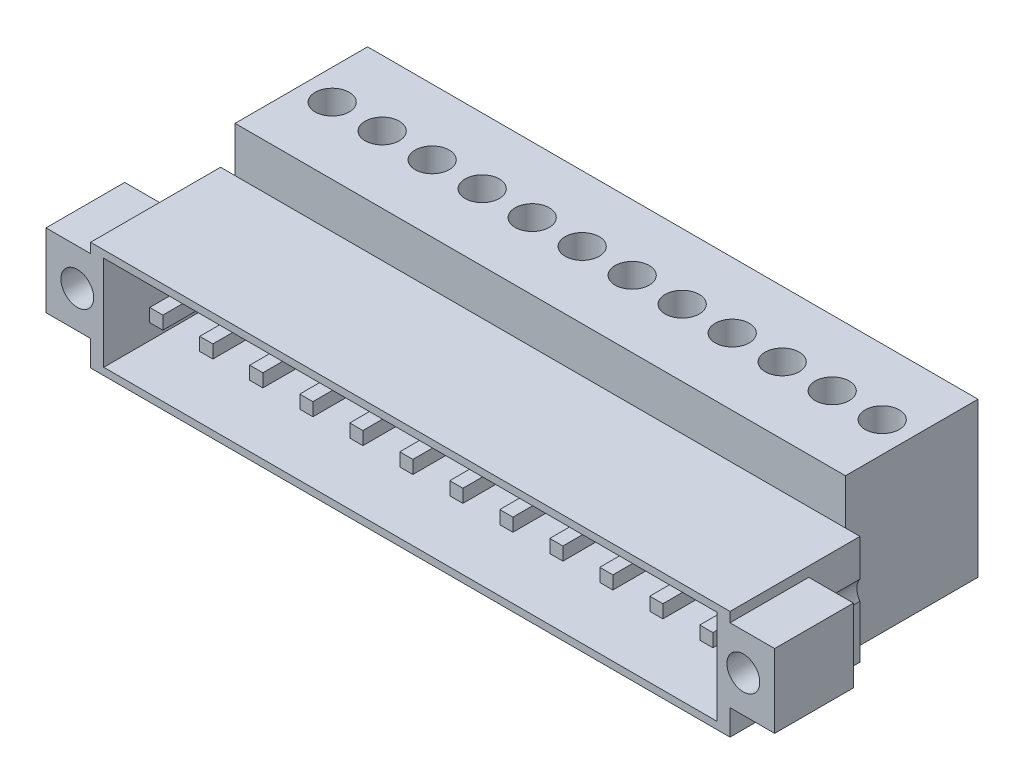
from build123d import *

# Parameters (mm, degrees)
SK_SHROUD_W             = 48.72
SK_SHROUD_H             = 8.3
SHROUD_DEPTH            = 9.9
SK_FLANGE_EARS_W        = 3.4
SK_FLANGE_EARS_H        = 5.6
FLANGE_EARS_DEPTH       = 6
SK_CAVITY_W             = 46.72
SK_CAVITY_H             = 7.2
CAVITY_DEPTH            = 7.6
SK_TERMINAL_BLOCK_W     = 46.51
SK_TERMINAL_BLOCK_H     = 11.75
TERMINAL_BLOCK_DEPTH    = 10.1
INSERT_HOLES_DEPTH      = 34.295909659
INSERT_HOLES_DEPTH_BACK = 34.295909659
SK_INSERT_HOLES_R       = 1.25
SK_CONTACT_PINS_W       = 1
SK_CONTACT_PINS_H       = 1
CONTACT_PINS_DEPTH      = 6
SK_WIRE_ENTRIES_W       = 2.6
SK_WIRE_ENTRIES_H       = 2.8
WIRE_ENTRIES_DEPTH      = 6
SK_CLAMP_SCREW_HOLES_R  = 1.3
CLAMP_SCREW_HOLES_DEPTH = 3


with BuildPart() as part:
    # SK Shroud → Shroud (new body)
    with BuildSketch(Plane.XY.offset(3)):
        with Locations((0, -0.6)):
            Rectangle(SK_SHROUD_W, SK_SHROUD_H)
    extrude(amount=-SHROUD_DEPTH)

    # SK Flange ears → Flange ears (add)
    with BuildSketch(Plane.XY.offset(3)):
        with Locations((26.06, 0)):
            Rectangle(SK_FLANGE_EARS_W, SK_FLANGE_EARS_H)
        with Locations((-26.06, 0)):
            Rectangle(SK_FLANGE_EARS_W, SK_FLANGE_EARS_H)
    extrude(amount=-FLANGE_EARS_DEPTH)

    # SK Cavity → Cavity (cut)
    with BuildSketch(Plane.XY.offset(3)):
        with Locations((0, -0.6)):
            Rectangle(SK_CAVITY_W, SK_CAVITY_H)
    extrude(amount=-CAVITY_DEPTH, mode=Mode.SUBTRACT)

    # SK Terminal block → Terminal block (add)
    with BuildSketch(Plane.XY.offset(-6.9)):
        with Locations((0, 1.125)):
            Rectangle(SK_TERMINAL_BLOCK_W, SK_TERMINAL_BLOCK_H)
    extrude(amount=-TERMINAL_BLOCK_DEPTH)

    # SK Insert holes → Insert holes (cut, two sides: drawn at the far end of the back side and taken through both)
    with BuildSketch(Plane.XY.offset(-INSERT_HOLES_DEPTH_BACK)):
        with Locations((-25.375, 0)):
            Circle(SK_INSERT_HOLES_R)
        with Locations((25.375, 0)):
            Circle(SK_INSERT_HOLES_R)
    extrude(amount=INSERT_HOLES_DEPTH + INSERT_HOLES_DEPTH_BACK, mode=Mode.SUBTRACT)

    # SK Contact pins → Contact pins (add)
    with BuildSketch(Plane.XY.offset(-4.6)):
        with Locations((-20.955, -0.6)):
            Rectangle(SK_CONTACT_PINS_W, SK_CONTACT_PINS_H)
        with Locations((-17.145, -0.6)):
            Rectangle(SK_CONTACT_PINS_W, SK_CONTACT_PINS_H)
        with Locations((-13.335, -0.6)):
            Rectangle(SK_CONTACT_PINS_W, SK_CONTACT_PINS_H)
        with Locations((-9.525, -0.6)):
            Rectangle(SK_CONTACT_PINS_W, SK_CONTACT_PINS_H)
        with Locations((-5.715, -0.6)):
            Rectangle(SK_CONTACT_PINS_W, SK_CONTACT_PINS_H)
        with Locations((-1.905, -0.6)):
            Rectangle(SK_CONTACT_PINS_W, SK_CONTACT_PINS_H)
        with Locations((1.905, -0.6)):
            Rectangle(SK_CONTACT_PINS_W, SK_CONTACT_PINS_H)
        with Locations((5.715, -0.6)):
            Rectangle(SK_CONTACT_PINS_W, SK_CONTACT_PINS_H)
        with Locations((9.525, -0.6)):
            Rectangle(SK_CONTACT_PINS_W, SK_CONTACT_PINS_H)
        with Locations((13.335, -0.6)):
            Rectangle(SK_CONTACT_PINS_W, SK_CONTACT_PINS_H)
        with Locations((17.145, -0.6)):
            Rectangle(SK_CONTACT_PINS_W, SK_CONTACT_PINS_H)
        with Locations((20.955, -0.6)):
            Rectangle(SK_CONTACT_PINS_W, SK_CONTACT_PINS_H)
    extrude(amount=CONTACT_PINS_DEPTH)

    # SK Wire entries → Wire entries (cut)
    with BuildSketch(Plane.XY.offset(-17)):
        with Locations((-20.955, -2)):
            Rectangle(SK_WIRE_ENTRIES_W, SK_WIRE_ENTRIES_H)
        with Locations((-17.145, -2)):
            Rectangle(SK_WIRE_ENTRIES_W, SK_WIRE_ENTRIES_H)
        with Locations((-13.335, -2)):
            Rectangle(SK_WIRE_ENTRIES_W, SK_WIRE_ENTRIES_H)
        with Locations((-9.525, -2)):
            Rectangle(SK_WIRE_ENTRIES_W, SK_WIRE_ENTRIES_H)
        with Locations((-5.715, -2)):
            Rectangle(SK_WIRE_ENTRIES_W, SK_WIRE_ENTRIES_H)
        with Locations((-1.905, -2)):
            Rectangle(SK_WIRE_ENTRIES_W, SK_WIRE_ENTRIES_H)
        with Locations((1.905, -2)):
            Rectangle(SK_WIRE_ENTRIES_W, SK_WIRE_ENTRIES_H)
        with Locations((5.715, -2)):
            Rectangle(SK_WIRE_ENTRIES_W, SK_WIRE_ENTRIES_H)
        with Locations((9.525, -2)):
            Rectangle(SK_WIRE_ENTRIES_W, SK_WIRE_ENTRIES_H)
        with Locations((13.335, -2)):
            Rectangle(SK_WIRE_ENTRIES_W, SK_WIRE_ENTRIES_H)
        with Locations((17.145, -2)):
            Rectangle(SK_WIRE_ENTRIES_W, SK_WIRE_ENTRIES_H)
        with Locations((20.955, -2)):
            Rectangle(SK_WIRE_ENTRIES_W, SK_WIRE_ENTRIES_H)
    extrude(amount=WIRE_ENTRIES_DEPTH, mode=Mode.SUBTRACT)

    # SK Clamp screw holes → Clamp screw holes (cut)
    with BuildSketch(Plane(origin=(0, 7, 0), x_dir=(1, 0, 0), z_dir=(0, 1, 0))):
        with Locations(Location((-20.955, 12, 0), (0, 0, 270))):
            Circle(SK_CLAMP_SCREW_HOLES_R)
        with Locations(Location((-17.145, 12, 0), (0, 0, 270))):
            Circle(SK_CLAMP_SCREW_HOLES_R)
        with Locations(Location((-13.335, 12, 0), (0, 0, 270))):
            Circle(SK_CLAMP_SCREW_HOLES_R)
        with Locations(Location((-9.525, 12, 0), (0, 0, 270))):
            Circle(SK_CLAMP_SCREW_HOLES_R)
        with Locations(Location((-5.715, 12, 0), (0, 0, 270))):
            Circle(SK_CLAMP_SCREW_HOLES_R)
        with Locations(Location((-1.905, 12, 0), (0, 0, 270))):
            Circle(SK_CLAMP_SCREW_HOLES_R)
        with Locations(Location((1.905, 12, 0), (0, 0, 270))):
            Circle(SK_CLAMP_SCREW_HOLES_R)
        with Locations(Location((5.715, 12, 0), (0, 0, 270))):
            Circle(SK_CLAMP_SCREW_HOLES_R)
        with Locations(Location((9.525, 12, 0), (0, 0, 270))):
            Circle(SK_CLAMP_SCREW_HOLES_R)
        with Locations(Location((13.335, 12, 0), (0, 0, 270))):
            Circle(SK_CLAMP_SCREW_HOLES_R)
        with Locations(Location((17.145, 12, 0), (0, 0, 270))):
            Circle(SK_CLAMP_SCREW_HOLES_R)
        with Locations(Location((20.955, 12, 0), (0, 0, 270))):
            Circle(SK_CLAMP_SCREW_HOLES_R)
    extrude(amount=-CLAMP_SCREW_HOLES_DEPTH, mode=Mode.SUBTRACT)


solid = part.part
